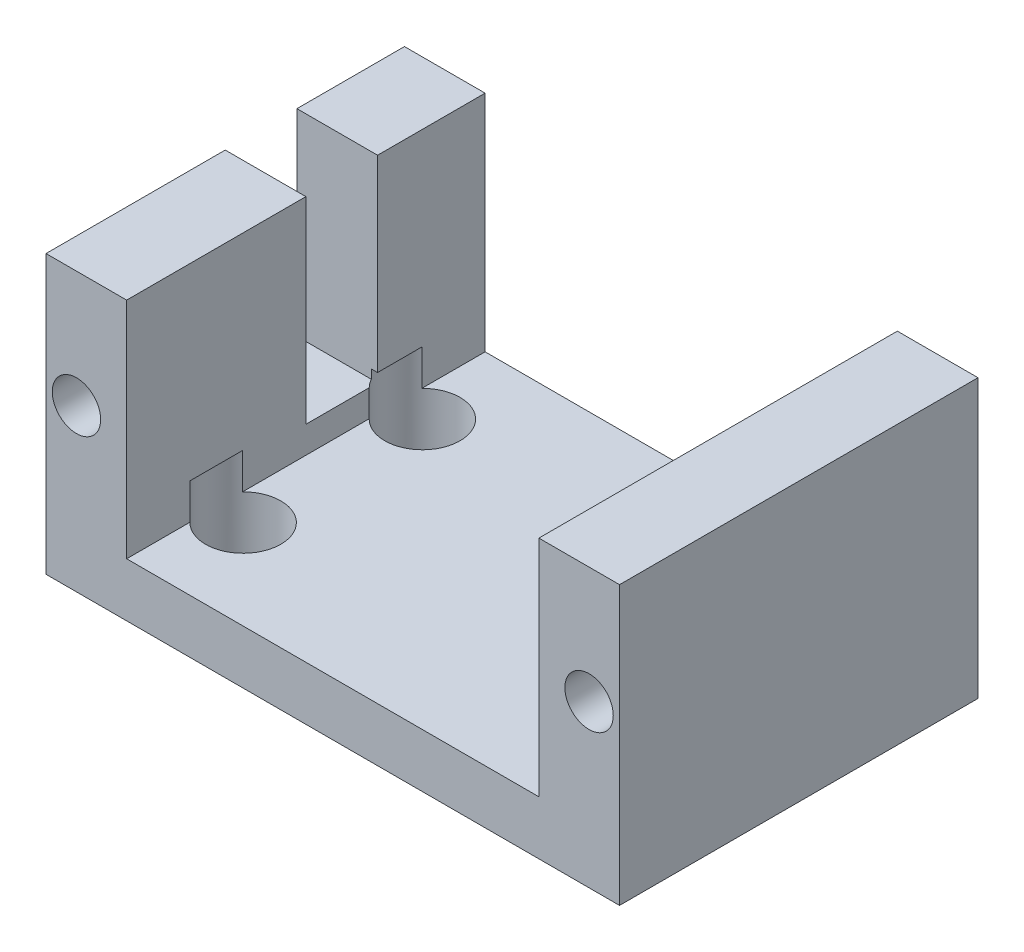
from build123d import *

# Parameters (mm, degrees)
SKETCH_4_W          = 32
SKETCH_4_H          = 15.5
EXTRUDE_2_DEPTH     = 20
SKETCH_6_W          = 23
SKETCH_6_H          = 12.5
CUT_EXTRUDE_1_DEPTH = 27.759344162
CUT_EXTRUDE_2_REACH = 40.524
SKETCH_7_W          = 4
SKETCH_7_H          = 11
SKETCH_9_R          = 1.35
CUT_EXTRUDE_3_DEPTH = 10
SKETCH_11_R         = 2.1
CUT_EXTRUDE_4_DEPTH = 5


with BuildPart() as part:
    # Эскиз4 → Бобышка-Вытянуть2 (new body)
    with BuildSketch(Plane.XY):
        Rectangle(SKETCH_4_W, SKETCH_4_H)
    extrude(amount=EXTRUDE_2_DEPTH)

    # Эскиз6 → Вырез-Вытянуть1 (cut, through all)
    with BuildSketch(Plane(origin=(0, 0, 0), x_dir=(-1, 0, 0), z_dir=(0, 0, -1))):
        with Locations((0, 1.5)):
            Rectangle(SKETCH_6_W, SKETCH_6_H)
    extrude(amount=-CUT_EXTRUDE_1_DEPTH, mode=Mode.SUBTRACT)

    # Эскиз7 → Вырез-Вытянуть2 (cut, up to next)
    with BuildSketch(Plane.ZY.offset(16), mode=Mode.PRIVATE) as cut_extrude_2_sk1:
        with Locations((8, 2.25)):
            Rectangle(SKETCH_7_W, SKETCH_7_H)
    cut_extrude_2_tool1 = extrude(cut_extrude_2_sk1.sketch, amount=-CUT_EXTRUDE_2_REACH, mode=Mode.PRIVATE) & part.part
    add(cut_extrude_2_tool1.solids().sort_by_distance((-16, 2.25, 8))[0], mode=Mode.SUBTRACT)

    # Эскиз9 → Вырез-Вытянуть3 (cut)
    with BuildSketch(Plane.XY.offset(20)):
        with Locations((-14.3, 1.25)):
            Circle(SKETCH_9_R)
        with Locations((14.3, 1.25)):
            Circle(SKETCH_9_R)
    extrude(amount=-CUT_EXTRUDE_3_DEPTH, mode=Mode.SUBTRACT)

    # Эскиз11 → Вырез-Вытянуть4 (cut)
    with BuildSketch(Plane.XZ.offset(7.75)):
        with Locations(Location((-10, 15, 0), (0, 0, 270))):
            Circle(SKETCH_11_R)
        with Locations(Location((10, 15, 0), (0, 0, 270))):
            Circle(SKETCH_11_R)
        with Locations(Location((10, 5, 0), (0, 0, 270))):
            Circle(SKETCH_11_R)
        with Locations(Location((-10, 5, 0), (0, 0, 270))):
            Circle(SKETCH_11_R)
    extrude(amount=-CUT_EXTRUDE_4_DEPTH, mode=Mode.SUBTRACT)


solid = part.part
